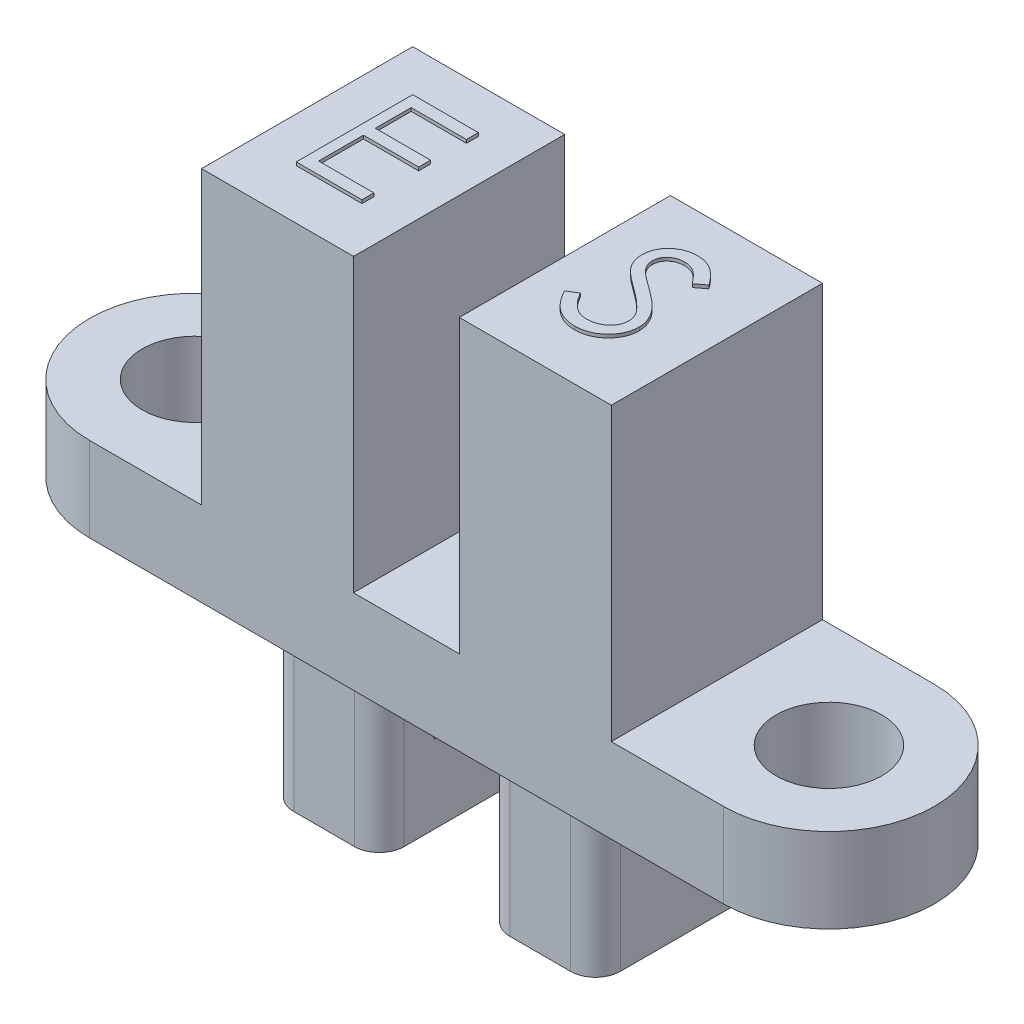
from build123d import *

# Parameters (mm, degrees)
SKETCH1_R                = 1.59
BOSS_EXTRUDE1_DEPTH      = 2.54
SKETCH2_W                = 4.57
SKETCH2_H                = 6.348981954
BOSS_EXTRUDE2_DEPTH      = 8.76
SKETCH3_W                = 3.32
SKETCH3_H                = 4.8
BOSS_EXTRUDE3_DEPTH      = 4.83
BOSS_EXTRUDE5_DEPTH      = 0.75
BOSS_EXTRUDE5_DEPTH_BACK = 0.75
SKETCH7_W                = 10.82
SKETCH7_H                = 5.8
SKETCH7_W_2              = 10.62
SKETCH7_H_2              = 5.6
CUT_EXTRUDE1_DEPTH       = 0.2
FILLET1_R                = 0.75
BOSS_EXTRUDE6_DEPTH      = 0.1


with BuildPart() as part:
    # Sketch1 → Boss-Extrude1 (new body)
    with BuildSketch(Plane(origin=(0, 0, 0), x_dir=(1, 0, 0), z_dir=(0, 1, 0))):
        with BuildLine():
            Line((9.53, 3.174490977), (-9.53, 3.174490977))
            ThreePointArc((-9.53, 3.174490977), (-12.704490977, 0), (-9.53, -3.174490977))
            Line((-9.53, -3.174490977), (9.53, -3.174490977))
            ThreePointArc((9.53, -3.174490977), (12.704490977, 0), (9.53, 3.174490977))
        make_face()
        with Locations(Location((-9.53, 0, 0), (0, 0, 270))):
            Circle(SKETCH1_R, mode=Mode.SUBTRACT)
        with Locations(Location((9.53, 0, 0), (0, 0, 90))):
            Circle(SKETCH1_R, mode=Mode.SUBTRACT)
    extrude(amount=BOSS_EXTRUDE1_DEPTH)

    # Sketch2 → Boss-Extrude2 (add)
    with BuildSketch(Plane(origin=(0, 2.54, 0), x_dir=(1, 0, 0), z_dir=(0, 1, 0))):
        with Locations((-3.875, 0)):
            Rectangle(SKETCH2_W, SKETCH2_H)
        with Locations((3.875, 0)):
            Rectangle(SKETCH2_W, SKETCH2_H)
    extrude(amount=BOSS_EXTRUDE2_DEPTH)

    # Sketch3 → Boss-Extrude3 (add)
    with BuildSketch(Plane.XZ):
        with Locations((3.25, 0)):
            Rectangle(SKETCH3_W, SKETCH3_H)
        with Locations((-3.25, 0)):
            Rectangle(SKETCH3_W, SKETCH3_H)
    extrude(amount=BOSS_EXTRUDE3_DEPTH)

    # Sketch6 → Boss-Extrude5 (add, two sides: drawn at the far end of the back side and taken through both)
    with BuildSketch(Plane.XY.offset(-BOSS_EXTRUDE5_DEPTH_BACK)):
        with BuildLine():
            Line((-1.59, -2.5), (-1.59, 0))
            Line((-1.59, 0), (1.59, 0))
            Line((1.59, 0), (1.59, -2.5))
            ThreePointArc((1.59, -2.5), (0, -0.91), (-1.59, -2.5))
        make_face()
    extrude(amount=BOSS_EXTRUDE5_DEPTH + BOSS_EXTRUDE5_DEPTH_BACK)

    # Sketch7 → Cut-Extrude1 (cut)
    with BuildSketch(Plane.XZ):
        Rectangle(SKETCH7_W, SKETCH7_H)
        Rectangle(SKETCH7_W_2, SKETCH7_H_2, mode=Mode.SUBTRACT)
    extrude(amount=-CUT_EXTRUDE1_DEPTH, mode=Mode.SUBTRACT)

    # Fillet1
    fillet1_edges = [part.edges().sort_by_distance(p)[0] for p in [
        (-1.59, -2.415, -2.4),
        (-1.59, -2.415, 2.4),
        (-4.91, -2.415, 2.4),
        (-4.91, -2.415, -2.4),
        (4.91, -2.415, -2.4),
        (4.91, -2.415, 2.4),
        (1.59, -2.415, 2.4),
        (1.59, -2.415, -2.4),
    ]]
    fillet(fillet1_edges, radius=FILLET1_R)

    # Sketch8 → Boss-Extrude6 (add)
    with BuildSketch(Plane(origin=(0, 11.3, 0), x_dir=(1, 0, 0), z_dir=(0, 1, 0))):
        Polygon((-4.811282051, 1.825509023), (-2.836923077, 1.825509023), (-2.836923077, 1.466534664), (-4.497179487, 1.466534664), (-4.497179487, 0.389611587), (-2.836923077, 0.389611587), (-2.836923077, 0.030637228), (-4.497179487, 0.030637228), (-4.497179487, -1.315516618), (-2.836923077, -1.315516618), (-2.836923077, -1.674490977), (-4.811282051, -1.674490977), align=None)
        with BuildLine():
            Line((2.57974359, -0.999310688), (2.875616987, -0.821926874))
            add(Edge.make_bspline(
                [(2.875616987, -0.821926874), (2.903135224, -0.867991259), (2.955859105, -0.956248843), (3.043810464, -1.075506883), (3.134943375, -1.17686904), (3.229932709, -1.259745648), (3.328198657, -1.324994534), (3.430382711, -1.371196766), (3.536140521, -1.400012742), (3.608114343, -1.403512828), (3.644046474, -1.405260207)],
                knots=[0, 0, 0, 0, 1.272034388, 2.437168799, 3.508375237, 4.49857839, 5.41946034, 6.295179144, 7.148887113, 8, 8, 8, 8], degree=3))
            add(Edge.make_bspline(
                [(3.644046474, -1.405260207), (3.674733335, -1.404405535), (3.735570108, -1.402711145), (3.825132351, -1.386430343), (3.912114153, -1.361418214), (3.994722791, -1.325597282), (4.071818405, -1.282258796), (4.139425101, -1.229912619), (4.197871214, -1.171306413), (4.245680328, -1.105923759), (4.282360364, -1.03560661), (4.310552432, -0.963430659), (4.326197506, -0.88826209), (4.328554259, -0.837651628), (4.32974359, -0.812111169)],
                knots=[0, 0, 0, 0, 1.095163259, 2.171163733, 3.241058638, 4.321873601, 5.38011039, 6.391990106, 7.366004449, 8.327778327, 9.272591725, 10.192022065, 11.087607919, 12, 12, 12, 12], degree=3))
            add(Edge.make_bspline(
                [(4.32974359, -0.812111169), (4.328269279, -0.782970319), (4.325272221, -0.72373123), (4.299940741, -0.636331577), (4.260091494, -0.549839007), (4.22332885, -0.496337742), (4.204242788, -0.468561489)],
                knots=[0, 0, 0, 0, 0.938893495, 1.908633276, 2.914225137, 4, 4, 4, 4], degree=3))
            add(Edge.make_bspline(
                [(4.204242788, -0.468561489), (4.188572174, -0.448514666), (4.15567368, -0.406428867), (4.099116167, -0.343783632), (4.032750053, -0.279165213), (3.958846498, -0.210106156), (3.874713409, -0.139818359), (3.782985895, -0.064950081), (3.681322036, 0.011651496), (3.610022539, 0.063024061), (3.573233173, 0.089531459)],
                knots=[0, 0, 0, 0, 0.722233717, 1.516239348, 2.393582979, 3.351407094, 4.387010283, 5.505090956, 6.712668013, 8, 8, 8, 8], degree=3))
            add(Edge.make_bspline(
                [(3.573233173, 0.089531459), (3.536409177, 0.115760047), (3.4660045, 0.165907109), (3.367545918, 0.240331393), (3.279501455, 0.308375263), (3.202262438, 0.370679275), (3.135862842, 0.427251879), (3.079779431, 0.477549819), (3.035440873, 0.522933379), (3.010785293, 0.552374721), (2.999715545, 0.565593158)],
                knots=[0, 0, 0, 0, 1.452282411, 2.77665338, 3.964542531, 5.026858415, 5.96415736, 6.766646006, 7.446254459, 8, 8, 8, 8], degree=3))
            add(Edge.make_bspline(
                [(2.999715545, 0.565593158), (2.984243, 0.586194195), (2.953814163, 0.626708899), (2.913648157, 0.690033756), (2.879508995, 0.754857022), (2.852746663, 0.821352886), (2.830210444, 0.888587815), (2.815052513, 0.957439061), (2.805561116, 1.027597679), (2.80458913, 1.07481118), (2.804102564, 1.098445722)],
                knots=[0, 0, 0, 0, 1.068054152, 2.10047183, 3.106115577, 4.101338837, 5.06977816, 6.043150881, 7.020423561, 8, 8, 8, 8], degree=3))
            add(Edge.make_bspline(
                [(2.804102564, 1.098445722), (2.805407773, 1.135475497), (2.807990293, 1.20874356), (2.82983081, 1.315774391), (2.864303704, 1.417960808), (2.912598592, 1.514291142), (2.974855945, 1.602257123), (3.046901919, 1.68287061), (3.132713405, 1.750639192), (3.226866029, 1.80985125), (3.329922401, 1.856197175), (3.437913304, 1.891158156), (3.551010376, 1.910967413), (3.627613511, 1.913810178), (3.666482372, 1.915252613)],
                knots=[0, 0, 0, 0, 1.005424448, 1.989358655, 2.955360095, 3.929531133, 4.905563448, 5.876582895, 6.856512386, 7.866279853, 8.892233794, 9.918561126, 10.94386622, 12, 12, 12, 12], degree=3))
            add(Edge.make_bspline(
                [(3.666482372, 1.915252613), (3.707726472, 1.913830061), (3.789747824, 1.91100106), (3.910397039, 1.886403529), (4.026557756, 1.845702857), (4.120001021, 1.799514199), (4.193133782, 1.753382784), (4.248906515, 1.711362959), (4.305423966, 1.662987851), (4.36314202, 1.608128605), (4.42108268, 1.546281854), (4.480106132, 1.477871165), (4.540350401, 1.403314609), (4.579106261, 1.350090108), (4.598974359, 1.322804696)],
                knots=[0, 0, 0, 0, 1.286793592, 2.559021753, 3.825965368, 5.121522368, 5.803751409, 6.523245864, 7.299691795, 8.125521123, 9.008227632, 9.944561021, 10.946284179, 12, 12, 12, 12], degree=3))
            Line((4.598974359, 1.322804696), (4.315020032, 1.107560305))
            add(Edge.make_bspline(
                [(4.315020032, 1.107560305), (4.2978741, 1.129648996), (4.264855043, 1.172186649), (4.214725556, 1.231757965), (4.167476908, 1.286174444), (4.120926508, 1.333439572), (4.077532876, 1.376141706), (4.035415834, 1.412701462), (3.995181483, 1.443477058), (3.944464572, 1.476320618), (3.880746854, 1.508877121), (3.800762318, 1.536426199), (3.717176043, 1.552981261), (3.660246411, 1.555170149), (3.631426282, 1.556278254)],
                knots=[0, 0, 0, 0, 1.181633172, 2.275549214, 3.290209073, 4.226197932, 5.078386478, 5.862611352, 6.581680152, 7.217281963, 8.414376989, 9.595101626, 10.782541182, 12, 12, 12, 12], degree=3))
            add(Edge.make_bspline(
                [(3.631426282, 1.556278254), (3.59526976, 1.555066554), (3.525545312, 1.552729905), (3.426555076, 1.52720992), (3.337461151, 1.487028059), (3.260908586, 1.430713081), (3.197171609, 1.363992089), (3.15106615, 1.287213233), (3.123315986, 1.202430831), (3.119929706, 1.143289175), (3.118205128, 1.11316928)],
                knots=[0, 0, 0, 0, 1.14458467, 2.207223713, 3.21896685, 4.227309161, 5.202851033, 6.127160689, 7.046193047, 8, 8, 8, 8], degree=3))
            add(Edge.make_bspline(
                [(3.118205128, 1.11316928), (3.118598255, 1.094417801), (3.119385151, 1.056884182), (3.130359949, 1.00143276), (3.144459278, 0.94612142), (3.166801909, 0.891198838), (3.197647213, 0.835704478), (3.238152389, 0.778682741), (3.289165701, 0.719631032), (3.328242713, 0.681223658), (3.348874199, 0.660945722)],
                knots=[0, 0, 0, 0, 0.858281714, 1.717966888, 2.583508476, 3.4729293, 4.427298488, 5.488583878, 6.674047936, 8, 8, 8, 8], degree=3))
            add(Edge.make_bspline(
                [(3.348874199, 0.660945722), (3.356535571, 0.654108696), (3.374737238, 0.637865488), (3.408013164, 0.611273207), (3.451955962, 0.578470435), (3.505418163, 0.537883118), (3.569385525, 0.490801656), (3.643865081, 0.437828044), (3.728026614, 0.377242585), (3.78774853, 0.334885045), (3.819326923, 0.31248819)],
                knots=[0, 0, 0, 0, 0.420754252, 0.999615792, 1.744751191, 2.668019286, 3.750313428, 4.999500688, 6.413464383, 8, 8, 8, 8], degree=3))
            add(Edge.make_bspline(
                [(3.819326923, 0.31248819), (3.857312836, 0.28484683), (3.930867293, 0.231323169), (4.035524873, 0.150907489), (4.130418681, 0.07225972), (4.215881884, -0.004117887), (4.292758793, -0.07764598), (4.360196513, -0.14920916), (4.418882194, -0.218294733), (4.482061412, -0.306867309), (4.546619232, -0.415648393), (4.602060739, -0.548926632), (4.637019087, -0.682722952), (4.641590602, -0.772649789), (4.643846154, -0.817019022)],
                knots=[0, 0, 0, 0, 1.163667725, 2.253281268, 3.268753668, 4.215851969, 5.092017293, 5.902905408, 6.650798638, 7.335211899, 8.59617414, 9.77448103, 10.901945474, 12, 12, 12, 12], degree=3))
            add(Edge.make_bspline(
                [(4.643846154, -0.817019022), (4.643189016, -0.848397387), (4.641887501, -0.91054477), (4.626926587, -1.001799847), (4.605006922, -1.090430717), (4.571969688, -1.175341829), (4.53164653, -1.258086592), (4.480480282, -1.336494492), (4.421172597, -1.412300891), (4.353138832, -1.483484382), (4.27869293, -1.548830578), (4.200009235, -1.60695964), (4.116958962, -1.655427963), (4.029992645, -1.694978805), (3.939090309, -1.725912323), (3.844282525, -1.748325192), (3.745413014, -1.762080903), (3.678212532, -1.763508664), (3.644046474, -1.764234566)],
                knots=[0, 0, 0, 0, 0.983748083, 1.948392443, 2.894712957, 3.844097841, 4.80183111, 5.778335162, 6.776009319, 7.81870978, 8.863265674, 9.881300176, 10.883814829, 11.87499822, 12.874611388, 13.892143829, 14.928324115, 16, 16, 16, 16], degree=3))
            add(Edge.make_bspline(
                [(3.644046474, -1.764234566), (3.617611131, -1.763723385), (3.565073371, -1.762707459), (3.487363889, -1.753726179), (3.4112243, -1.741019075), (3.337610018, -1.720845005), (3.265572607, -1.696368028), (3.195425372, -1.666229696), (3.127134318, -1.630112494), (3.060316735, -1.58881747), (2.995142561, -1.540759725), (2.932223093, -1.484786229), (2.869493907, -1.422440724), (2.808806511, -1.35203016), (2.748933367, -1.274692078), (2.691054957, -1.189702894), (2.633973239, -1.09752554), (2.598157772, -1.032660455), (2.57974359, -0.999310688)],
                knots=[0, 0, 0, 0, 0.915332311, 1.819136955, 2.706846663, 3.586547465, 4.459518054, 5.340707479, 6.227863349, 7.133153174, 8.059268498, 9.028702269, 10.047606654, 11.120612155, 12.245963614, 13.433783089, 14.680604001, 16, 16, 16, 16], degree=3))
        make_face()
    extrude(amount=BOSS_EXTRUDE6_DEPTH)


solid = part.part
